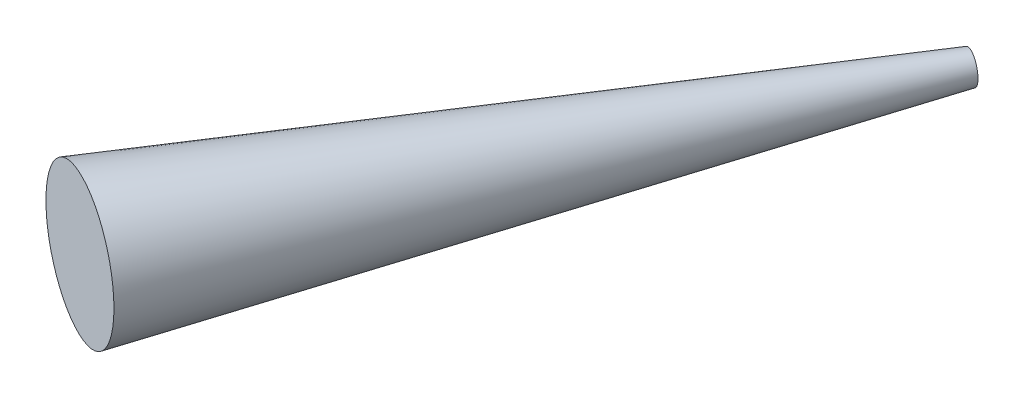
from build123d import *


with BuildPart() as part:
    # Sketch1 → Revolve1 (revolve)
    with BuildSketch(Plane(origin=(0, 0, 0), x_dir=(1, 0, 0), z_dir=(0, 1, 0))):
        Polygon((-29.248077874, -40.048643009), (-118.551117592, -231.559629708), (-98.42250179, -240.945757405), (-24.736915452, -41.601960799), align=None)
    revolve(axis=Axis((-29.248077874, 0, 40.048643009), (-0.4226182617407002, 0, 0.9063077870366496)))


solid = part.part
